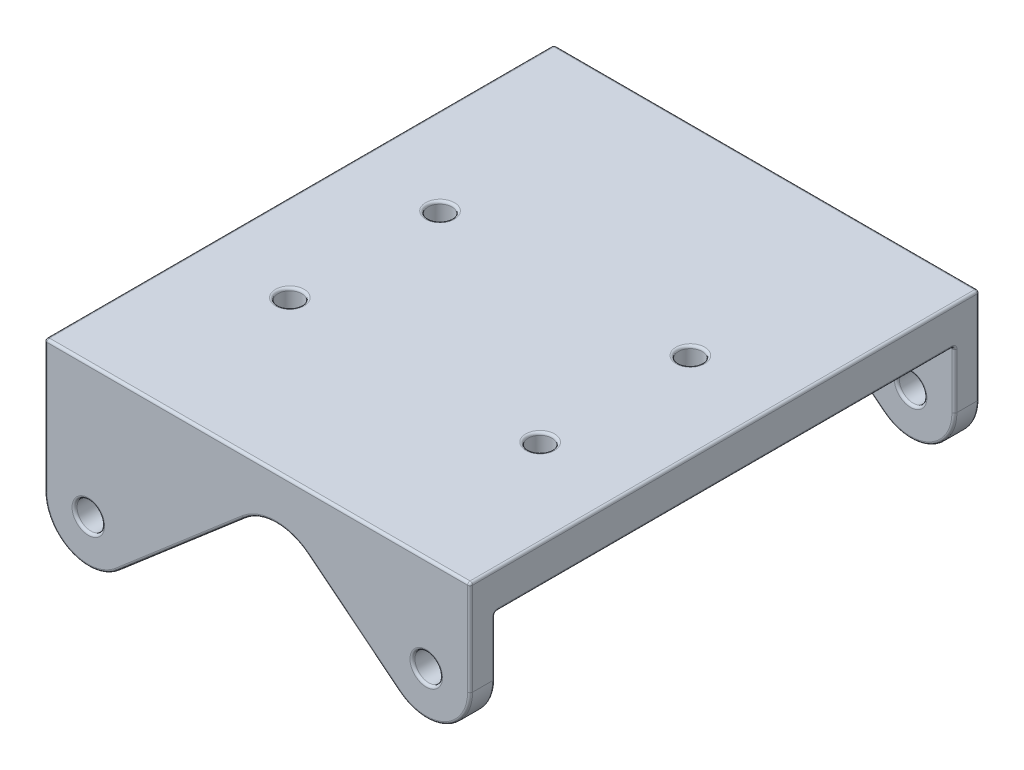
from build123d import *

# Parameters (mm, degrees)
SKETCH_1_R          = 1.1
EXTRUDE_1_DEPTH     = 2
SKETCH_1_3_W        = 34
SKETCH_1_3_H        = 3
EXTRUDE_2_DEPTH     = 18.35
SKETCH_2_R          = 0.95
CUT_EXTRUDE_1_DEPTH = 46.15251931
FILLET_1_R          = 0.2


with BuildPart() as part:
    # 스케치1 → 보스-돌출1 (new body)
    with BuildSketch(Plane.XY):
        with BuildLine():
            ThreePointArc((-18.5, -3), (-16.460603203, -6.180666327), (-12.719063837, -5.654680814))
            Line((-12.719063837, -5.654680814), (-2.606784186, 3.03392093))
            ThreePointArc((-2.606784186, 3.03392093), (-0.069370269, 3.999398425), (2.5, 3.122498999))
            Line((2.5, 3.122498999), (9.8125, -2.732186624))
            ThreePointArc((9.8125, -2.732186624), (13.515544457, -3.154857366), (15.5, 0))
            Line((15.5, 0), (15.5, 7.6))
            Line((15.5, 7.6), (-18.5, 7.6))
            Line((-18.5, 7.6), (-18.5, -3))
        make_face()
        with Locations((-15, -3)):
            Circle(SKETCH_1_R, mode=Mode.SUBTRACT)
        with Locations((12, 0)):
            Circle(SKETCH_1_R, mode=Mode.SUBTRACT)
    extrude(amount=EXTRUDE_1_DEPTH)

    # 스케치1<3> → 보스-돌출2 (add)
    with BuildSketch(Plane.XY):
        with Locations((-1.5, 6.1)):
            Rectangle(SKETCH_1_3_W, SKETCH_1_3_H)
    extrude(amount=-EXTRUDE_2_DEPTH)

    # 대칭 복사1: part across plane


with BuildPart() as part_1:
    add(part.part)
    add(part.part.mirror(Plane.XY.offset(-18.35)))

    # 스케치2 → 컷-돌출1 (cut, through all)
    with BuildSketch(Plane(origin=(0, 7.6, 0), x_dir=(1, 0, 0), z_dir=(0, 1, 0))):
        with Locations((8.5, 10.6)):
            Circle(SKETCH_2_R)
        with Locations((8.5, 22.6)):
            Circle(SKETCH_2_R)
        with Locations((-11.5, 22.6)):
            Circle(SKETCH_2_R)
        with Locations((-11.5, 10.6)):
            Circle(SKETCH_2_R)
    extrude(amount=-CUT_EXTRUDE_1_DEPTH, mode=Mode.SUBTRACT)

    # 필렛1
    fillet_1_edges = [part_1.edges().sort_by_distance(p)[0] for p in [
        (-16.460603203, -6.180666327, 0),
        (-7.662924012, -1.310379942, 0),
        (-0.069370269, 3.999398425, 0),
        (6.15625, 0.195156187, 0),
        (13.515544457, -3.154857366, 0),
        (15.5, 2.3, 0),
        (-18.5, 0.8, 0),
        (-16.1, -3, 0),
        (10.9, 0, 0),
        (15.5, 2.3, -36.7),
        (13.515544457, -3.154857366, -36.7),
        (6.15625, 0.195156187, -36.7),
        (-0.069370269, 3.999398425, -36.7),
        (-7.662924012, -1.310379942, -36.7),
        (-16.460603203, -6.180666327, -36.7),
        (-18.5, 0.8, -36.7),
        (-16.1, -3, -36.7),
        (10.9, 0, -36.7),
        (-16.460603203, -6.180666327, -38.7),
        (-7.662924012, -1.310379942, -38.7),
        (-0.069370269, 3.999398425, -38.7),
        (6.15625, 0.195156187, -38.7),
        (13.515544457, -3.154857366, -38.7),
        (15.5, 3.8, -38.7),
        (-18.5, 2.3, -38.7),
        (-16.1, -3, -38.7),
        (10.9, 0, -38.7),
        (15.5, 4.6, -18.35),
        (-1.5, 4.6, -36.7),
        (-18.5, 4.6, -18.35),
        (-1.5, 4.6, 0),
        (7.55, 4.6, -10.6),
        (7.55, 4.6, -22.6),
        (-12.45, 4.6, -22.6),
        (-12.45, 4.6, -10.6),
        (15.5, 3.8, 2),
        (13.515544457, -3.154857366, 2),
        (6.15625, 0.195156187, 2),
        (-0.069370269, 3.999398425, 2),
        (-7.662924012, -1.310379942, 2),
        (-16.460603203, -6.180666327, 2),
        (-18.5, 2.3, 2),
        (-16.1, -3, 2),
        (10.9, 0, 2),
        (-1.5, 7.6, 2),
        (-18.5, 7.6, -18.35),
        (-1.5, 7.6, -38.7),
        (15.5, 7.6, -18.35),
        (7.55, 7.6, -10.6),
        (7.55, 7.6, -22.6),
        (-12.45, 7.6, -22.6),
        (-12.45, 7.6, -10.6),
    ]]
    fillet(fillet_1_edges, radius=FILLET_1_R)


solid = part_1.part
